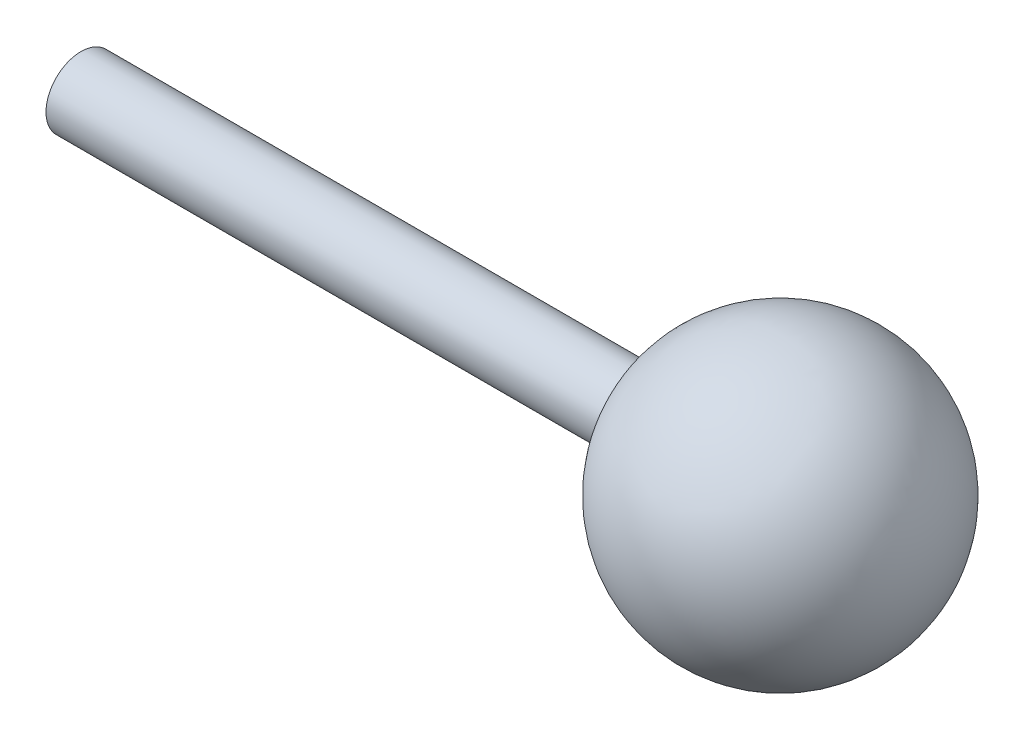
from build123d import *


with BuildPart() as part:
    # Sketch1 → Revolve1 (revolve)
    with BuildSketch(Plane.XY, mode=Mode.PRIVATE) as revolve1_sk:
        with BuildLine():
            Line((0, 0), (300, 0))
            ThreePointArc((300, 0), (256.300214624, 49.601484813), (201.587708172, 12.5))
            Line((201.587708172, 12.5), (0, 12.5))
            Line((0, 12.5), (0, 0))
        make_face()
    revolve(revolve1_sk.sketch.rotate(Axis((-17.802445557, 0, 0), (1, 0, 0)), 90), axis=Axis((-17.802445557, 0, 0), (1, 0, 0)))


solid = part.part
